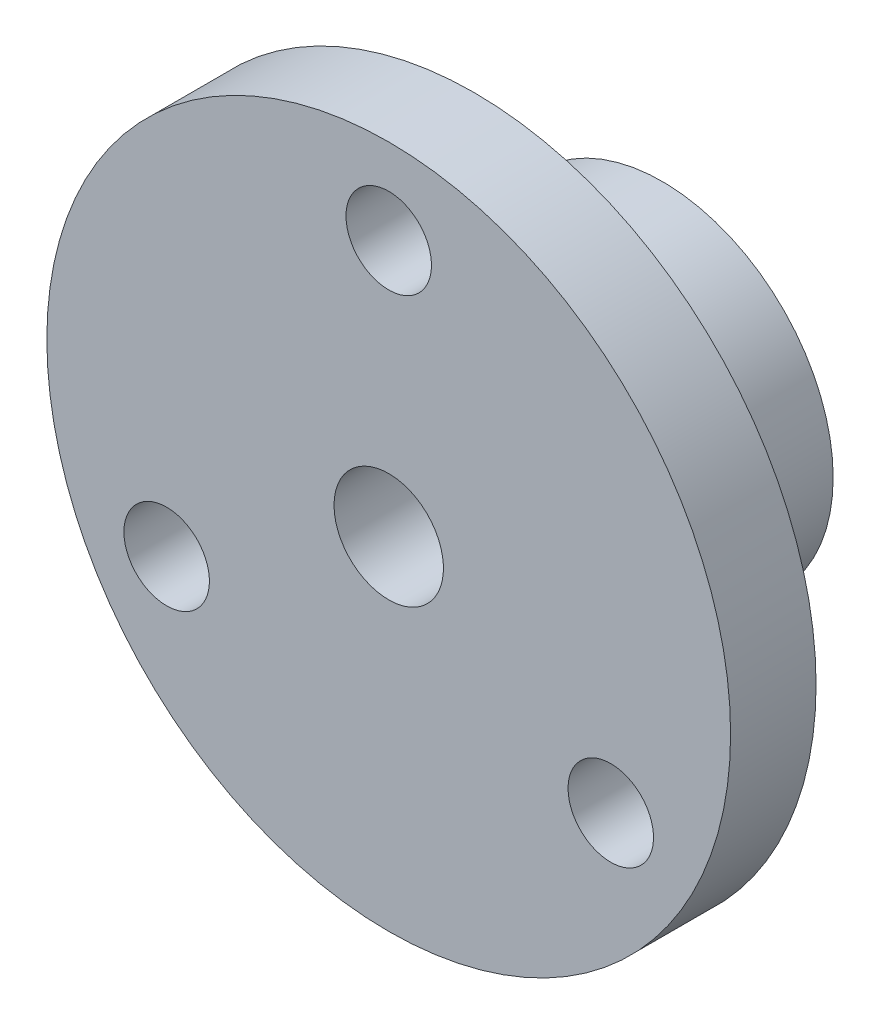
from build123d import *

# Parameters (mm, degrees)
SKETCH3_R                   = 4.064
CUT_EXTRUDE1_DEPTH          = 42.270115096
F_1_4_20_TAPPED_HOLE1_D     = 5.1054
F_1_4_20_TAPPED_HOLE1_DEPTH = 10.16
F_1_4_20_TAPPED_HOLE1_TIP   = 1.533816902
CIRPATTERN1_COUNT           = 3


with BuildPart() as part:
    # Sketch1 → Revolve1 (revolve)
    with BuildSketch(Plane(origin=(0, 0, 0), x_dir=(0, 0, -1), z_dir=(1, 0, 0)), mode=Mode.PRIVATE) as revolve1_sk:
        Polygon((0, 12.7), (-13.97, 12.7), (-13.97, 25.4), (-20.32, 25.4), (-20.32, 0), (0, 0), align=None)
    revolve(revolve1_sk.sketch.rotate(Axis((0, 0, 20.32), (0, 0, -1)), 90), axis=Axis((0, 0, 20.32), (0, 0, -1)))

    # Sketch3 → Cut-Extrude1 (cut, through all)
    with BuildSketch(Plane(origin=(0, 0, 0), x_dir=(-1, 0, 0), z_dir=(0, 0, -1))):
        Circle(SKETCH3_R)
    extrude(amount=-CUT_EXTRUDE1_DEPTH, mode=Mode.SUBTRACT)

    # 1/4-20 Tapped Hole1
    with Locations(Plane(origin=(0, 12.7, 7.62), x_dir=(1, 0, 0), z_dir=(0, 1, 0))):
        with Locations((0, 0)):
            Hole(F_1_4_20_TAPPED_HOLE1_D / 2, depth=F_1_4_20_TAPPED_HOLE1_DEPTH)
            with Locations((0, 0, -(F_1_4_20_TAPPED_HOLE1_DEPTH + F_1_4_20_TAPPED_HOLE1_TIP / 2))):  # 118° drill point
                Cone(0, F_1_4_20_TAPPED_HOLE1_D / 2, F_1_4_20_TAPPED_HOLE1_TIP, mode=Mode.SUBTRACT)

    # Sketch7 → 1/4 (0.25) Diameter Hole1 (revolve, cut)
    with BuildSketch(Plane(origin=(0, 19.05, 13.97), x_dir=(0, 1, 0), z_dir=(1, 0, 0))):
        Polygon((0, 0), (0, 20.957732465), (3.175, 19.05), (3.175, 0), align=None)
    f_1_4_0_25_diameter_hole1 = revolve(axis=Axis((0, 19.05, 7.62), (0, 0, 1)), mode=Mode.SUBTRACT)

    # CirPattern1: 1/4 (0.25) Diameter Hole1 ×3 about axis
    cirpattern1_axis = Axis((0, 0, 0), (0, 0, 1))
    for i in range(1, CIRPATTERN1_COUNT):
        add(f_1_4_0_25_diameter_hole1.rotate(cirpattern1_axis, i * 360 / CIRPATTERN1_COUNT), mode=Mode.SUBTRACT)


solid = part.part
